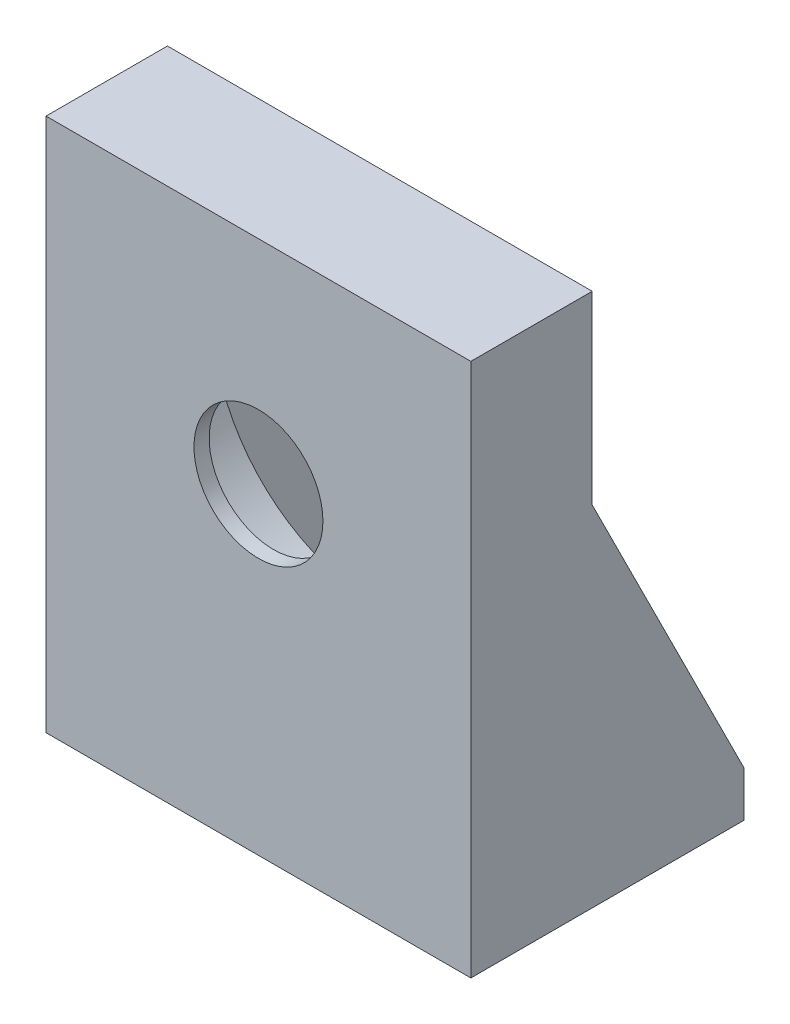
from build123d import *

# Parameters (mm, degrees)
SKETCH2_W           = 28
SKETCH2_H           = 35.2
SKETCH2_R           = 11
BOSS_EXTRUDE3_DEPTH = 7
SKETCH3_W           = 10
SKETCH3_H           = 3
BOSS_EXTRUDE4_DEPTH = 28
BOSS_EXTRUDE5_DEPTH = 3
BOSS_EXTRUDE6_START = -28
BOSS_EXTRUDE6_DEPTH = 3
SKETCH4_R           = 2
CUT_EXTRUDE1_DEPTH  = 101.089134132
BOSS_EXTRUDE7_START = 1
SKETCH2_3_W         = 28
SKETCH2_3_H         = 35.2
SKETCH2_3_R         = 11
SKETCH2_3_R_2       = 10.7
SKETCH2_3_R_3       = 9.65
SKETCH2_3_R_4       = 4.25
BOSS_EXTRUDE7_DEPTH = 1


with BuildPart() as part:
    # Sketch2 → Boss-Extrude3 (new body)
    with BuildSketch(Plane.XY.offset(-2.538447986)):
        with Locations((-78.732107824, 19.43595021)):
            Rectangle(SKETCH2_W, SKETCH2_H)
        with Locations((-78.732107824, 23.03595021)):
            Circle(SKETCH2_R, mode=Mode.SUBTRACT)
    extrude(amount=-BOSS_EXTRUDE3_DEPTH)

    # Sketch3 → Boss-Extrude4 (add)
    with BuildSketch(Plane.ZY.offset(92.732107824)):
        with Locations((-14.538447986, 3.33595021)):
            Rectangle(SKETCH3_W, SKETCH3_H)
    extrude(amount=-BOSS_EXTRUDE4_DEPTH)

    # Sketch3<3> → Boss-Extrude5 (add)
    with BuildSketch(Plane.ZY.offset(92.732107824)):
        Polygon((-19.538447986, 4.83595021), (-9.538447986, 4.83595021), (-9.538447986, 24.83595021), align=None)
    extrude(amount=-BOSS_EXTRUDE5_DEPTH)

    # Sketch3<4> → Boss-Extrude6 (add)
    with BuildSketch(Plane.ZY.offset(92.732107824).offset(BOSS_EXTRUDE6_START)):
        Polygon((-19.538447986, 4.83595021), (-9.538447986, 4.83595021), (-9.538447986, 24.83595021), align=None)
    extrude(amount=BOSS_EXTRUDE6_DEPTH)

    # Sketch4 → Cut-Extrude1 (cut, through all)
    with BuildSketch(Plane(origin=(0, 4.83595021, 0), x_dir=(1, 0, 0), z_dir=(0, 1, 0))):
        with Locations(Location((-72.732107824, 14.538447986, 0), (0, 0, 270))):
            Circle(SKETCH4_R)
        with Locations(Location((-84.732107824, 14.538447986, 0), (0, 0, 90))):
            Circle(SKETCH4_R)
    extrude(amount=-CUT_EXTRUDE1_DEPTH, mode=Mode.SUBTRACT)

    # Sketch2<3> → Boss-Extrude7 (add)
    # profile 1 of 4: a face of its own
    with BuildSketch(Plane.XY.offset(-2.538447986).offset(BOSS_EXTRUDE7_START)):
        with Locations((-78.732107824, 19.43595021)):
            Rectangle(SKETCH2_3_W, SKETCH2_3_H)
        with Locations((-78.732107824, 23.03595021)):
            Circle(SKETCH2_3_R, mode=Mode.SUBTRACT)
    # profile 2 of 4: a face of its own
    with BuildSketch(Plane.XY.offset(-2.538447986).offset(BOSS_EXTRUDE7_START)):
        with Locations((-78.732107824, 23.03595021)):
            Circle(SKETCH2_3_R)
        with Locations((-78.732107824, 23.03595021)):
            Circle(SKETCH2_3_R_2, mode=Mode.SUBTRACT)
    # profile 3 of 4: a face of its own
    with BuildSketch(Plane.XY.offset(-2.538447986).offset(BOSS_EXTRUDE7_START)):
        with Locations((-78.732107824, 23.03595021)):
            Circle(SKETCH2_3_R_2)
        with Locations((-78.732107824, 23.03595021)):
            Circle(SKETCH2_3_R_3, mode=Mode.SUBTRACT)
    # profile 4 of 4: a face of its own
    with BuildSketch(Plane.XY.offset(-2.538447986).offset(BOSS_EXTRUDE7_START)):
        with Locations((-78.732107824, 23.03595021)):
            Circle(SKETCH2_3_R_3)
        with Locations((-78.732107824, 23.03595021)):
            Circle(SKETCH2_3_R_4, mode=Mode.SUBTRACT)
    extrude(amount=-BOSS_EXTRUDE7_DEPTH)


solid = part.part
